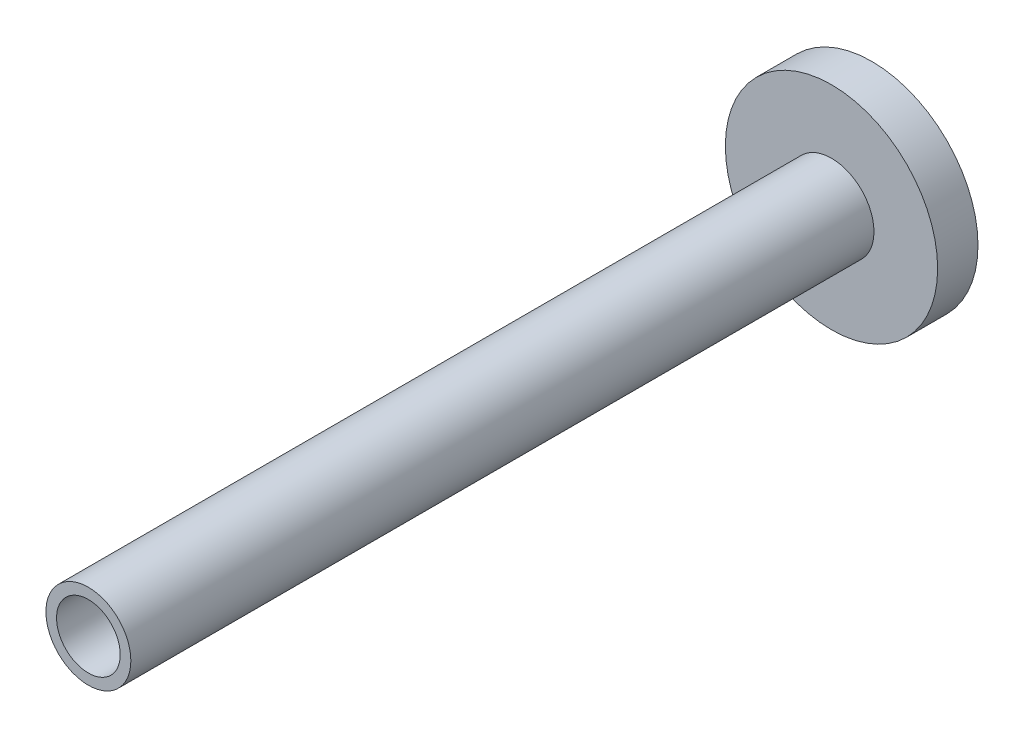
from build123d import *

# Parameters (mm, degrees)
SKETCH_1_R          = 5
EXTRUDE_1_DEPTH     = 1.9
SKETCH_2_R          = 2
EXTRUDE_2_DEPTH     = 35
SKETCH_3_R          = 1.5
CUT_EXTRUDE_1_DEPTH = 12


with BuildPart() as part:
    # 草图1 → 凸台-拉伸1 (new body)
    with BuildSketch(Plane.XY):
        with Locations(Location((0, 0, 0), (0, 0, 180))):
            Circle(SKETCH_1_R)
    extrude(amount=EXTRUDE_1_DEPTH)

    # 草图2 → 凸台-拉伸2 (add)
    with BuildSketch(Plane.XY.offset(1.9)):
        Circle(SKETCH_2_R)
    extrude(amount=EXTRUDE_2_DEPTH)

    # 草图3 → 切除-拉伸1 (cut)
    with BuildSketch(Plane.XY.offset(36.9)):
        Circle(SKETCH_3_R)
    extrude(amount=-CUT_EXTRUDE_1_DEPTH, mode=Mode.SUBTRACT)


solid = part.part
